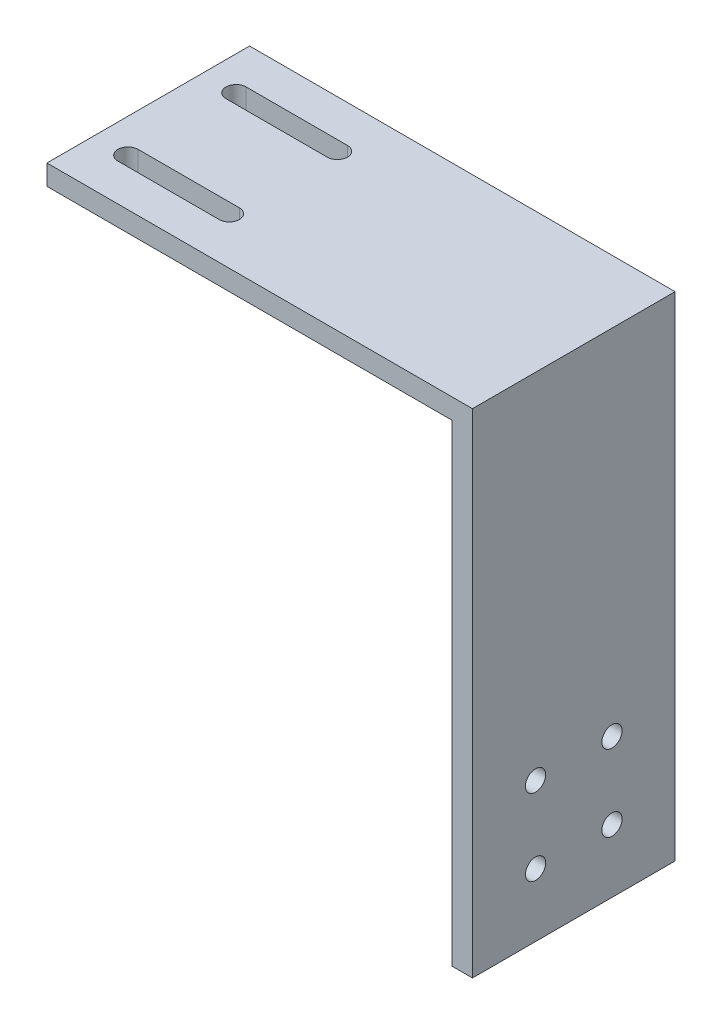
from build123d import *

# Parameters (mm, degrees)
SALIENTE_EXTRUIR1_DEPTH = 30
CORTAR_EXTRUIR1_DEPTH   = 3
CROQUIS3_R              = 1.5
CORTAR_EXTRUIR2_DEPTH   = 3


with BuildPart() as part:
    # Croquis1 → Saliente-Extruir1 (new body)
    with BuildSketch(Plane.XY):
        Polygon((-64.928571429, 65.135714286), (-64.928571429, 62.135714286), (-4.928571429, 62.135714286), (-4.928571429, -7.864285714), (-1.928571429, -7.864285714), (-1.928571429, 65.135714286), align=None)
    extrude(amount=SALIENTE_EXTRUIR1_DEPTH)

    # Croquis2 → Cortar-Extruir1 (cut)
    with BuildSketch(Plane(origin=(0, 65.135714286, 0), x_dir=(1, 0, 0), z_dir=(0, 1, 0))):
        with BuildLine():
            Line((-59.928571429, -24.5), (-44.928571429, -24.5))
            ThreePointArc((-44.928571429, -24.5), (-43.428571429, -23), (-44.928571429, -21.5))
            Line((-44.928571429, -21.5), (-59.928571429, -21.5))
            ThreePointArc((-59.928571429, -21.5), (-61.428571429, -23), (-59.928571429, -24.5))
        make_face()
        with BuildLine():
            Line((-59.928571429, -8.5), (-44.928571429, -8.5))
            ThreePointArc((-44.928571429, -8.5), (-43.428571429, -7), (-44.928571429, -5.5))
            Line((-44.928571429, -5.5), (-59.928571429, -5.5))
            ThreePointArc((-59.928571429, -5.5), (-61.428571429, -7), (-59.928571429, -8.5))
        make_face()
    extrude(amount=-CORTAR_EXTRUIR1_DEPTH, mode=Mode.SUBTRACT)

    # Croquis3 → Cortar-Extruir2 (cut)
    with BuildSketch(Plane.ZY.offset(4.928571429)):
        with Locations(Location((20.656854249, 1.478860036, 0), (0, 0, 270))):
            Circle(CROQUIS3_R)
        with Locations(Location((9.343145751, 1.478860036, 0), (0, 0, 270))):
            Circle(CROQUIS3_R)
        with Locations(Location((9.343145751, 12.792568535, 0), (0, 0, 270))):
            Circle(CROQUIS3_R)
        with Locations(Location((20.656854249, 12.792568535, 0), (0, 0, 270))):
            Circle(CROQUIS3_R)
    extrude(amount=-CORTAR_EXTRUIR2_DEPTH, mode=Mode.SUBTRACT)


solid = part.part
